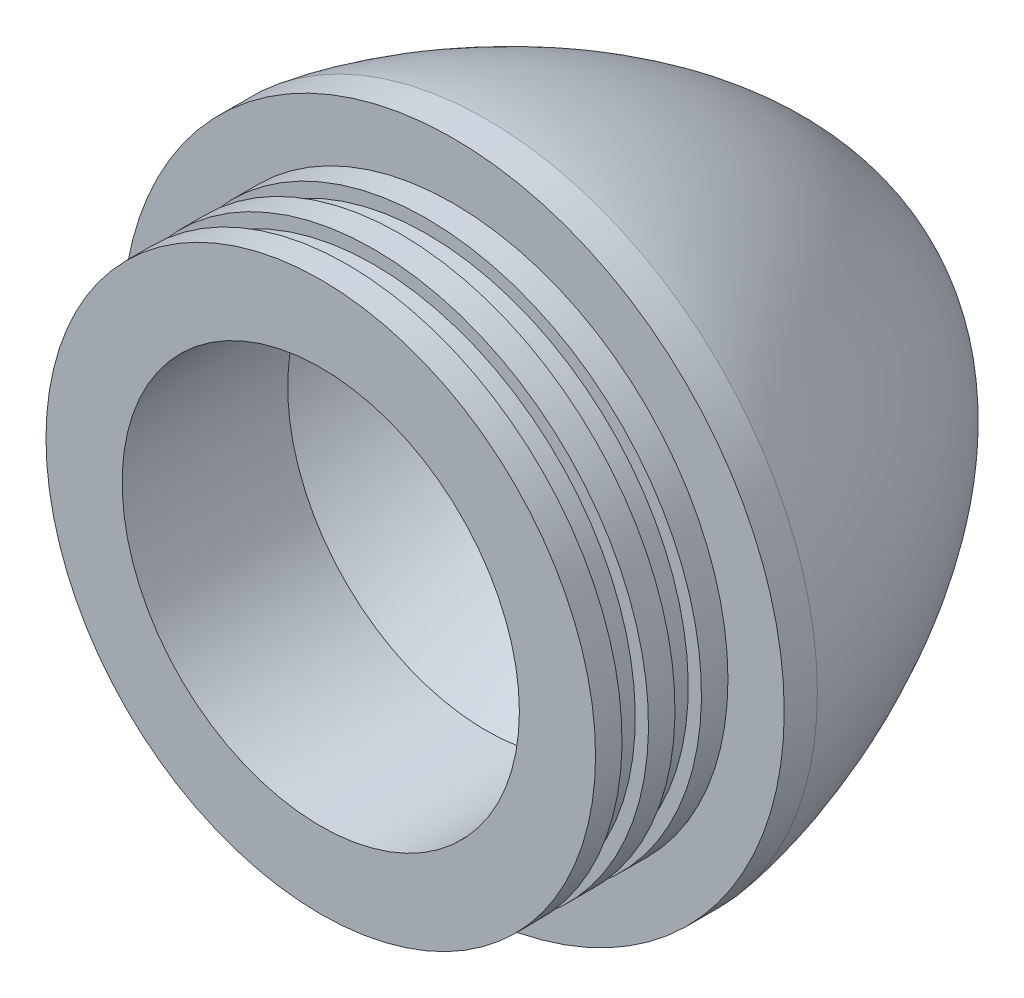
from build123d import *

# Parameters (mm, degrees)
SKETCH1_R           = 50
BOSS_EXTRUDE1_DEPTH = 5
SKETCH2_R           = 41.5
BOSS_EXTRUDE2_DEPTH = 20
SKETCH4_W           = 4
SKETCH4_H           = 2
SKETCH6_R           = 30
CUT_EXTRUDE1_DEPTH  = 76


with BuildPart() as part:
    # Sketch1 → Boss-Extrude1 (new body)
    with BuildSketch(Plane.XY):
        Circle(SKETCH1_R)
    extrude(amount=BOSS_EXTRUDE1_DEPTH)

    # Sketch2 → Boss-Extrude2 (add)
    with BuildSketch(Plane.XY.offset(5)):
        Circle(SKETCH2_R)
    extrude(amount=BOSS_EXTRUDE2_DEPTH)

    # Sketch4 → Cut-Revolve1 (revolve, cut)
    with BuildSketch(Plane(origin=(0, 0, 0), x_dir=(0, 0, -1), z_dir=(1, 0, 0))):
        with Locations((-11, 40.5)):
            Rectangle(SKETCH4_W, SKETCH4_H)
        with Locations((-19, 40.5)):
            Rectangle(SKETCH4_W, SKETCH4_H)
    revolve(axis=Axis((0, 0, 0), (0, 0, 1)), mode=Mode.SUBTRACT)

    # Sketch6 → Cut-Extrude1 (cut, through all)
    with BuildSketch(Plane.XY.offset(25)):
        Circle(SKETCH6_R)
    extrude(amount=-CUT_EXTRUDE1_DEPTH, mode=Mode.SUBTRACT)

    # Sketch5 → Revolve2 (revolve)
    with BuildSketch(Plane(origin=(0, 0, 0), x_dir=(0, 0, -1), z_dir=(1, 0, 0)), mode=Mode.PRIVATE) as revolve2_sk:
        with BuildLine():
            add(Edge.make_bspline(
                [(60, 0), (60, -30), (18.341729935, -47.585265444), (0, -50)],
                knots=[0, 0, 0, 0, 1, 1, 1, 1], degree=3))
            Line((60, 0), (57, 0))
            add(Edge.make_bspline(
                [(57, 0), (57, -0.839529251), (56.926216151, -2.532697799), (56.498585906, -5.787348513), (55.464384581, -9.710785416), (53.492757525, -14.183558613), (49.97819358, -19.848130616), (44.10315688, -26.337560331), (35.370011046, -33.045053917), (27.328482154, -37.640390457), (20.829690882, -40.681617372), (16.022193995, -42.637477595), (11.381613041, -44.261311839), (7.738449227, -45.332702164), (5.011819594, -46.017990599), (3.073688428, -46.445655401), (1.563551079, -46.729287857), (0.591183995, -46.88571964), (0.174241223, -46.947356625), (0.033004859, -46.967504681), (0, -46.972173716)],
                knots=[0, 0, 0, 0, 0.03125, 0.0625, 0.125, 0.1875, 0.25, 0.375, 0.5, 0.625, 0.6875, 0.75, 0.8125, 0.875, 0.90625, 0.9375, 0.96875, 0.984375, 0.990544401, 0.99243552, 0.99243552, 0.99243552, 0.99243552], degree=3))
            Line((0, -46.972173716), (0, -50))
        make_face()
    revolve(revolve2_sk.sketch.rotate(Axis((0, 0, 0), (0, 0, -1)), 180), axis=Axis((0, 0, 0), (0, 0, -1)))


solid = part.part
